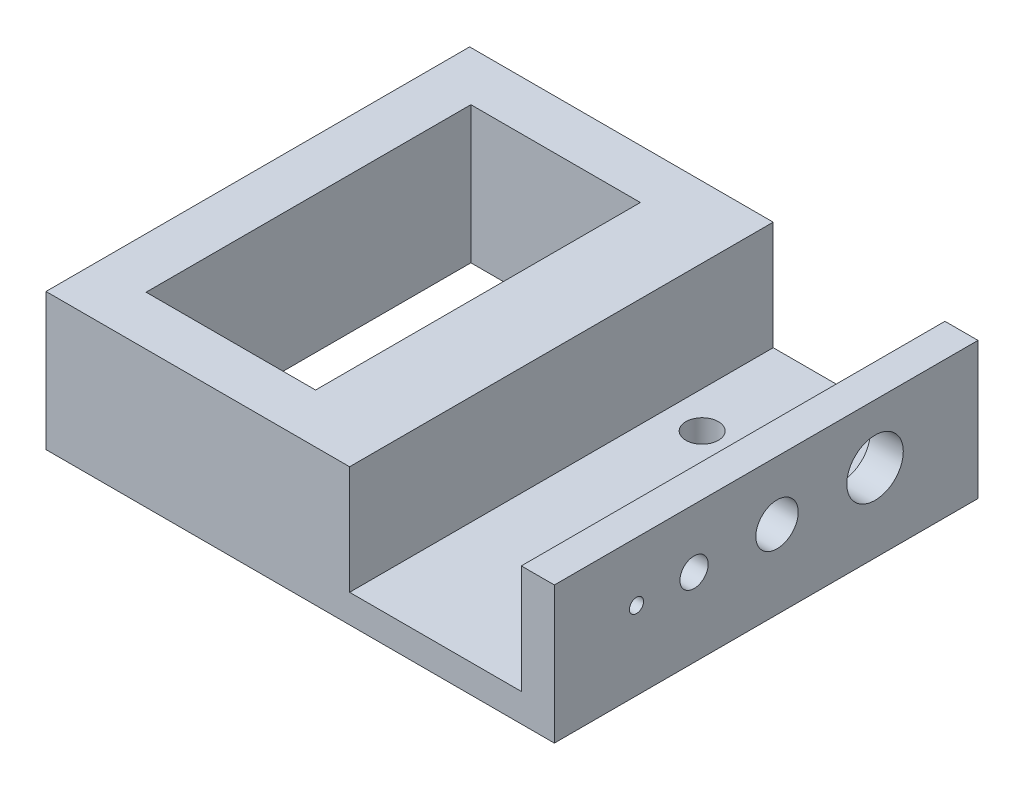
from build123d import *

# Parameters (mm, degrees)
SKETCH_1_W          = 36
SKETCH_1_H          = 30
EXTRUDE_1_DEPTH     = 10
EXTRUDE_2_DEPTH     = 6
SKETCH_2_W          = 12.160825217
SKETCH_2_H          = 34.685599871
CUT_EXTRUDE_1_DEPTH = 8
SKETCH_3_R          = 0.5
SKETCH_3_R_2        = 1
SKETCH_3_R_3        = 1.5
SKETCH_3_R_4        = 2
CUT_EXTRUDE_2_DEPTH = 8
SKETCH_4_R          = 4.417962551
CUT_EXTRUDE_3_DEPTH = 0.1
SKETCH_5_R          = 5.05323065
CUT_EXTRUDE_4_DEPTH = 1.4
SKETCH_6_R          = 1
CUT_EXTRUDE_6_DEPTH = 10
SKETCH_11_R         = 2.55
SKETCH_11_R_2       = 1
EXTRUDE_3_DEPTH     = 5
SKETCH_12_OUTSIDE_W = 48.152
SKETCH_12_OUTSIDE_H = 42.152
SKETCH_12_OUTSIDE_R = 2.1
CUT_EXTRUDE_7_DEPTH = 9.5
SKETCH_13_R         = 1.15
CUT_EXTRUDE_8_DEPTH = 13.5
SKETCH_14_W         = 102.67858786
SKETCH_14_H         = 80.280273631
CUT_EXTRUDE_9_DEPTH = 0.3


with BuildPart() as part:
    # 草图1 → 凸台-拉伸1 (new body)
    with BuildSketch(Plane(origin=(0, 0, 0), x_dir=(1, 0, 0), z_dir=(0, 1, 0))):
        Rectangle(SKETCH_1_W, SKETCH_1_H)
        Polygon((-14.41025641, 11.5), (-2.41025641, 11.5), (-2.41025641, 7.376281108), (-2.41025641, -11.5), (-14.41025641, -11.5), align=None, mode=Mode.SUBTRACT)
    extrude(amount=EXTRUDE_1_DEPTH)

    # 草图1<4> → 凸台-拉伸2 (add)
    with BuildSketch(Plane(origin=(0, 0, 0), x_dir=(1, 0, 0), z_dir=(0, 1, 0))):
        with BuildLine():
            ThreePointArc((8.63974359, 7.376281108), (6.08974359, 9.926281108), (3.53974359, 7.376281108))
            ThreePointArc((3.53974359, 7.376281108), (6.08974359, 4.826281108), (8.63974359, 7.376281108))
        make_face()
    extrude(amount=-EXTRUDE_2_DEPTH)

    # 草图2 → 切除-拉伸1 (cut)
    with BuildSketch(Plane(origin=(0, 10, 0), x_dir=(1, 0, 0), z_dir=(0, 1, 0))):
        with Locations((9.579402218, 0.667301742)):
            Rectangle(SKETCH_2_W, SKETCH_2_H)
    extrude(amount=-CUT_EXTRUDE_1_DEPTH, mode=Mode.SUBTRACT)

    # 草图3 → 切除-拉伸2 (cut)
    with BuildSketch(Plane(origin=(18, 0, 0), x_dir=(0, 0, -1), z_dir=(1, 0, 0))):
        with Locations((-9.184219858, 5.534894538)):
            Circle(SKETCH_3_R)
        with Locations((-5.107163581, 5.534894538)):
            Circle(SKETCH_3_R_2)
        with Locations((0.769869669, 5.534894538)):
            Circle(SKETCH_3_R_3)
        with Locations((7.709539928, 5.534894538)):
            Circle(SKETCH_3_R_4)
    extrude(amount=-CUT_EXTRUDE_2_DEPTH, mode=Mode.SUBTRACT)

    # 草图4 → 切除-拉伸3 (cut)
    with BuildSketch(Plane.XZ.offset(6)):
        with Locations((5.795390071, -7.128470111)):
            Circle(SKETCH_4_R)
    extrude(amount=-CUT_EXTRUDE_3_DEPTH, mode=Mode.SUBTRACT)

    # 草图5 → 切除-拉伸4 (cut)
    with BuildSketch(Plane.XZ.offset(5.9)):
        with Locations((5.767325228, -7.296859169)):
            Circle(SKETCH_5_R)
    extrude(amount=-CUT_EXTRUDE_4_DEPTH, mode=Mode.SUBTRACT)

    # 草图6 → 切除-拉伸6 (cut)
    with BuildSketch(Plane.XZ.offset(4.5)):
        with Locations((6.08974359, -7.376281108)):
            Circle(SKETCH_6_R)
    extrude(amount=-CUT_EXTRUDE_6_DEPTH, mode=Mode.SUBTRACT)

    # 草图11 → 凸台-拉伸3 (add)
    with BuildSketch(Plane.XZ.offset(4.5)):
        with Locations((6.08974359, -7.376281108)):
            Circle(SKETCH_11_R)
        with Locations((6.08974359, -7.376281108)):
            Circle(SKETCH_11_R_2, mode=Mode.SUBTRACT)
    extrude(amount=EXTRUDE_3_DEPTH)

    # 草图12 outside → 切除-拉伸7 (cut)
    with BuildSketch(Plane.XZ.offset(9.5)):
        Rectangle(SKETCH_12_OUTSIDE_W, SKETCH_12_OUTSIDE_H)
        with Locations((6.08974359, -7.376281108)):
            Circle(SKETCH_12_OUTSIDE_R, mode=Mode.SUBTRACT)
    extrude(amount=-CUT_EXTRUDE_7_DEPTH, mode=Mode.SUBTRACT)

    # 草图13 → 切除-拉伸8 (cut)
    with BuildSketch(Plane.XZ.offset(9.5)):
        with Locations((6.08974359, -7.376281108)):
            Circle(SKETCH_13_R)
    extrude(amount=-CUT_EXTRUDE_8_DEPTH, mode=Mode.SUBTRACT)

    # 草图14 → 切除-拉伸9 (cut)
    with BuildSketch(Plane(origin=(0, 10, 0), x_dir=(1, 0, 0), z_dir=(0, 1, 0))):
        with Locations((-27.117967051, 18.219550081)):
            Rectangle(SKETCH_14_W, SKETCH_14_H)
    extrude(amount=-CUT_EXTRUDE_9_DEPTH, mode=Mode.SUBTRACT)


solid = part.part
